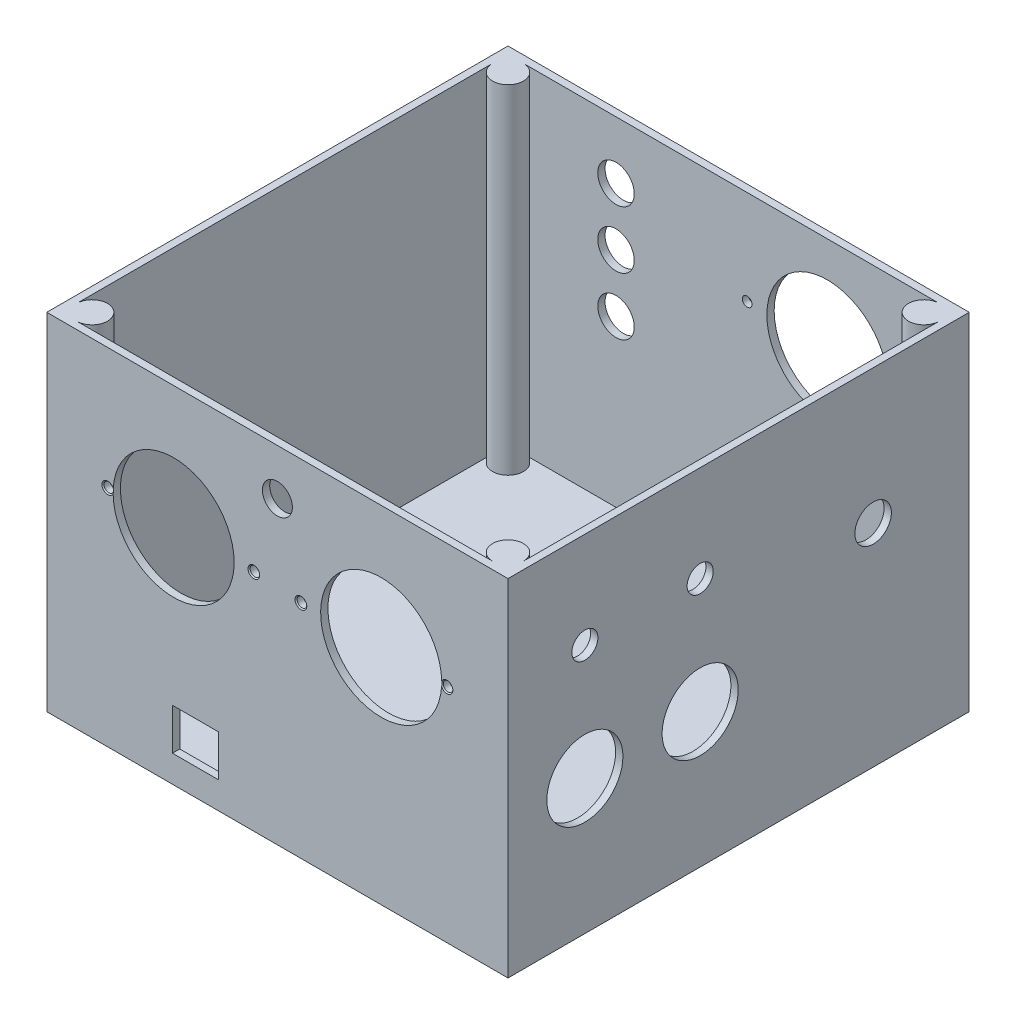
from build123d import *

# Parameters (mm, degrees)
SKETCH1_W                   = 120
SKETCH1_H                   = 120
BOSS_EXTRUDE1_DEPTH         = 90
SKETCH2_W                   = 116.2
SKETCH2_H                   = 116.2
CUT_EXTRUDE1_DEPTH          = 88
BOSS_EXTRUDE2_DEPTH         = 88
CUT_EXTRUDE2_REACH          = 194.094
SKETCH5_R                   = 4.75
SKETCH5_R_2                 = 15.75
CUT_EXTRUDE3_REACH          = 194.094
SKETCH4_R                   = 3.9
SKETCH4_R_2                 = 15.75
SKETCH4_W                   = 12
SKETCH4_H                   = 10.8
CUT_EXTRUDE4_REACH          = 194.094
SKETCH6_R                   = 4.75
SKETCH6_R_2                 = 3.4
SKETCH6_R_3                 = 9.9
M3_TAPPED_HOLE1_D           = 2.5
M3_TAPPED_HOLE1_CSINK_D     = 3.05
M3_TAPPED_HOLE1_CSINK_ANGLE = 90
M3_TAPPED_HOLE3_D           = 2.5
M3_TAPPED_HOLE3_DEPTH       = 7.5
M3_TAPPED_HOLE3_CSINK_D     = 3.05
M3_TAPPED_HOLE3_CSINK_ANGLE = 90
M3_TAPPED_HOLE3_TIP         = 0.751075774
M3_TAPPED_HOLE4_D           = 2.5
M3_TAPPED_HOLE4_DEPTH       = 7.5
M3_TAPPED_HOLE4_CSINK_D     = 3.05
M3_TAPPED_HOLE4_CSINK_ANGLE = 90
M3_TAPPED_HOLE4_TIP         = 0.751075774


with BuildPart() as part:
    # Sketch1 → Boss-Extrude1 (new body)
    with BuildSketch(Plane(origin=(0, 0, 0), x_dir=(1, 0, 0), z_dir=(0, 1, 0))):
        with Locations((60, 60)):
            Rectangle(SKETCH1_W, SKETCH1_H)
    extrude(amount=BOSS_EXTRUDE1_DEPTH)

    # Sketch2 → Cut-Extrude1 (cut)
    with BuildSketch(Plane(origin=(0, 90, 0), x_dir=(1, 0, 0), z_dir=(0, 1, 0))):
        with Locations((60, 60)):
            Rectangle(SKETCH2_W, SKETCH2_H)
    extrude(amount=-CUT_EXTRUDE1_DEPTH, mode=Mode.SUBTRACT)

    # Sketch3 → Boss-Extrude2 (add)
    with BuildSketch(Plane(origin=(0, 2, 0), x_dir=(1, 0, 0), z_dir=(0, 1, 0))):
        with BuildLine():
            Line((5.9, 118.1), (1.9, 118.1))
            Line((1.9, 118.1), (1.9, 114.1))
            ThreePointArc((1.9, 114.1), (8.728427125, 111.271572875), (5.9, 118.1))
        make_face()
        with BuildLine():
            Line((114.1, 118.1), (118.1, 118.1))
            Line((118.1, 118.1), (118.1, 114.1))
            ThreePointArc((118.1, 114.1), (111.271572875, 111.271572875), (114.1, 118.1))
        make_face()
        with BuildLine():
            Line((118.1, 1.9), (118.1, 5.9))
            ThreePointArc((118.1, 5.9), (111.271572875, 8.728427125), (114.1, 1.9))
            Line((114.1, 1.9), (118.1, 1.9))
        make_face()
        with BuildLine():
            Line((1.9, 1.9), (1.9, 5.9))
            ThreePointArc((1.9, 5.9), (8.728427125, 8.728427125), (5.9, 1.9))
            Line((5.9, 1.9), (1.9, 1.9))
        make_face()
    extrude(amount=BOSS_EXTRUDE2_DEPTH)

    # Sketch5 → Cut-Extrude2 (cut, up to next)
    with BuildSketch(Plane.XY.offset(-120), mode=Mode.PRIVATE) as cut_extrude2_sk1:
        with Locations(Location((30, 75, 0), (0, 0, 180))):
            Circle(SKETCH5_R)
    cut_extrude2_tool1 = extrude(cut_extrude2_sk1.sketch, amount=CUT_EXTRUDE2_REACH, mode=Mode.PRIVATE) & part.part
    # Sketch5 → Cut-Extrude2 (cut, up to next)
    with BuildSketch(Plane.XY.offset(-120), mode=Mode.PRIVATE) as cut_extrude2_sk2:
        with Locations(Location((85, 65, 0), (0, 0, 180))):
            Circle(SKETCH5_R_2)
    cut_extrude2_tool2 = extrude(cut_extrude2_sk2.sketch, amount=CUT_EXTRUDE2_REACH, mode=Mode.PRIVATE) & part.part
    # Sketch5 → Cut-Extrude2 (cut, up to next)
    with BuildSketch(Plane.XY.offset(-120), mode=Mode.PRIVATE) as cut_extrude2_sk3:
        with Locations(Location((30, 60, 0), (0, 0, 180))):
            Circle(SKETCH5_R)
    cut_extrude2_tool3 = extrude(cut_extrude2_sk3.sketch, amount=CUT_EXTRUDE2_REACH, mode=Mode.PRIVATE) & part.part
    # Sketch5 → Cut-Extrude2 (cut, up to next)
    with BuildSketch(Plane.XY.offset(-120), mode=Mode.PRIVATE) as cut_extrude2_sk4:
        with Locations(Location((30, 45, 0), (0, 0, 180))):
            Circle(SKETCH5_R)
    cut_extrude2_tool4 = extrude(cut_extrude2_sk4.sketch, amount=CUT_EXTRUDE2_REACH, mode=Mode.PRIVATE) & part.part
    add(cut_extrude2_tool1.solids().sort_by_distance((30, 75, -120))[0], mode=Mode.SUBTRACT)
    add(cut_extrude2_tool2.solids().sort_by_distance((85, 65, -120))[0], mode=Mode.SUBTRACT)
    add(cut_extrude2_tool3.solids().sort_by_distance((30, 60, -120))[0], mode=Mode.SUBTRACT)
    add(cut_extrude2_tool4.solids().sort_by_distance((30, 45, -120))[0], mode=Mode.SUBTRACT)

    # Sketch4 → Cut-Extrude3 (cut, up to next)
    with BuildSketch(Plane.XY, mode=Mode.PRIVATE) as cut_extrude3_sk1:
        with Locations((60, 78)):
            Circle(SKETCH4_R)
    cut_extrude3_tool1 = extrude(cut_extrude3_sk1.sketch, amount=-CUT_EXTRUDE3_REACH, mode=Mode.PRIVATE) & part.part
    # Sketch4 → Cut-Extrude3 (cut, up to next)
    with BuildSketch(Plane.XY, mode=Mode.PRIVATE) as cut_extrude3_sk2:
        with Locations((33, 58)):
            Circle(SKETCH4_R_2)
    cut_extrude3_tool2 = extrude(cut_extrude3_sk2.sketch, amount=-CUT_EXTRUDE3_REACH, mode=Mode.PRIVATE) & part.part
    # Sketch4 → Cut-Extrude3 (cut, up to next)
    with BuildSketch(Plane.XY, mode=Mode.PRIVATE) as cut_extrude3_sk3:
        with Locations((87, 58)):
            Circle(SKETCH4_R_2)
    cut_extrude3_tool3 = extrude(cut_extrude3_sk3.sketch, amount=-CUT_EXTRUDE3_REACH, mode=Mode.PRIVATE) & part.part
    # Sketch4 → Cut-Extrude3 (cut, up to next)
    with BuildSketch(Plane.XY, mode=Mode.PRIVATE) as cut_extrude3_sk4:
        with Locations((38.7, 12.4)):
            Rectangle(SKETCH4_W, SKETCH4_H)
    cut_extrude3_tool4 = extrude(cut_extrude3_sk4.sketch, amount=-CUT_EXTRUDE3_REACH, mode=Mode.PRIVATE) & part.part
    add(cut_extrude3_tool1.solids().sort_by_distance((60, 78, 0))[0], mode=Mode.SUBTRACT)
    add(cut_extrude3_tool2.solids().sort_by_distance((33, 58, 0))[0], mode=Mode.SUBTRACT)
    add(cut_extrude3_tool3.solids().sort_by_distance((87, 58, 0))[0], mode=Mode.SUBTRACT)
    add(cut_extrude3_tool4.solids().sort_by_distance((38.7, 12.4, 0))[0], mode=Mode.SUBTRACT)

    # Sketch6 → Cut-Extrude4 (cut, up to next)
    with BuildSketch(Plane(origin=(120, 0, 0), x_dir=(0, 0, -1), z_dir=(1, 0, 0)), mode=Mode.PRIVATE) as cut_extrude4_sk1:
        with Locations((95, 55)):
            Circle(SKETCH6_R)
    cut_extrude4_tool1 = extrude(cut_extrude4_sk1.sketch, amount=-CUT_EXTRUDE4_REACH, mode=Mode.PRIVATE) & part.part
    # Sketch6 → Cut-Extrude4 (cut, up to next)
    with BuildSketch(Plane(origin=(120, 0, 0), x_dir=(0, 0, -1), z_dir=(1, 0, 0)), mode=Mode.PRIVATE) as cut_extrude4_sk2:
        with Locations((20, 65)):
            Circle(SKETCH6_R_2)
    cut_extrude4_tool2 = extrude(cut_extrude4_sk2.sketch, amount=-CUT_EXTRUDE4_REACH, mode=Mode.PRIVATE) & part.part
    # Sketch6 → Cut-Extrude4 (cut, up to next)
    with BuildSketch(Plane(origin=(120, 0, 0), x_dir=(0, 0, -1), z_dir=(1, 0, 0)), mode=Mode.PRIVATE) as cut_extrude4_sk3:
        with Locations((50, 65)):
            Circle(SKETCH6_R_2)
    cut_extrude4_tool3 = extrude(cut_extrude4_sk3.sketch, amount=-CUT_EXTRUDE4_REACH, mode=Mode.PRIVATE) & part.part
    # Sketch6 → Cut-Extrude4 (cut, up to next)
    with BuildSketch(Plane(origin=(120, 0, 0), x_dir=(0, 0, -1), z_dir=(1, 0, 0)), mode=Mode.PRIVATE) as cut_extrude4_sk4:
        with Locations((20, 35)):
            Circle(SKETCH6_R_3)
    cut_extrude4_tool4 = extrude(cut_extrude4_sk4.sketch, amount=-CUT_EXTRUDE4_REACH, mode=Mode.PRIVATE) & part.part
    # Sketch6 → Cut-Extrude4 (cut, up to next)
    with BuildSketch(Plane(origin=(120, 0, 0), x_dir=(0, 0, -1), z_dir=(1, 0, 0)), mode=Mode.PRIVATE) as cut_extrude4_sk5:
        with Locations((50, 35)):
            Circle(SKETCH6_R_3)
    cut_extrude4_tool5 = extrude(cut_extrude4_sk5.sketch, amount=-CUT_EXTRUDE4_REACH, mode=Mode.PRIVATE) & part.part
    add(cut_extrude4_tool1.solids().sort_by_distance((120, 55, -95))[0], mode=Mode.SUBTRACT)
    add(cut_extrude4_tool2.solids().sort_by_distance((120, 65, -20))[0], mode=Mode.SUBTRACT)
    add(cut_extrude4_tool3.solids().sort_by_distance((120, 65, -50))[0], mode=Mode.SUBTRACT)
    add(cut_extrude4_tool4.solids().sort_by_distance((120, 35, -20))[0], mode=Mode.SUBTRACT)
    add(cut_extrude4_tool5.solids().sort_by_distance((120, 35, -50))[0], mode=Mode.SUBTRACT)

    # M3 Tapped Hole1 (through all)
    with Locations(Plane(origin=(44.517722268, 2, -162.246849146), x_dir=(1, 0, 0), z_dir=(0, 1, 0))):
        with Locations((-18.417722268, -139.446849146), (-3.217722268, -88.646849146), (24.682277732, -88.646849146), (29.382277732, -140.546849146)):
            CounterSinkHole(M3_TAPPED_HOLE1_D / 2, M3_TAPPED_HOLE1_CSINK_D / 2, counter_sink_angle=M3_TAPPED_HOLE1_CSINK_ANGLE)

    # M3 Tapped Hole3
    with Locations(Plane(origin=(44.517722268, -28.75570348, 0), x_dir=(1, 0, 0), z_dir=(0, 0, 1))):
        with Locations((-28.646696043, 87.124935168), (9.359552373, 87.17416606), (21.605003092, 86.3372409), (59.611251507, 86.386471792)):
            CounterSinkHole(M3_TAPPED_HOLE3_D / 2, M3_TAPPED_HOLE3_CSINK_D / 2, depth=M3_TAPPED_HOLE3_DEPTH, counter_sink_angle=M3_TAPPED_HOLE3_CSINK_ANGLE)
            with Locations((0, 0, -(M3_TAPPED_HOLE3_DEPTH + M3_TAPPED_HOLE3_TIP / 2))):  # 118° drill point
                Cone(0, M3_TAPPED_HOLE3_D / 2, M3_TAPPED_HOLE3_TIP, mode=Mode.SUBTRACT)

    # M3 Tapped Hole4
    with Locations(Plane(origin=(44.517722268, -28.75570348, -120), x_dir=(-1, 0, 0), z_dir=(0, 0, -1))):
        with Locations((-57.611251507, 94.124935168), (-19.605003092, 94.17416606)):
            CounterSinkHole(M3_TAPPED_HOLE4_D / 2, M3_TAPPED_HOLE4_CSINK_D / 2, depth=M3_TAPPED_HOLE4_DEPTH, counter_sink_angle=M3_TAPPED_HOLE4_CSINK_ANGLE)
            with Locations((0, 0, -(M3_TAPPED_HOLE4_DEPTH + M3_TAPPED_HOLE4_TIP / 2))):  # 118° drill point
                Cone(0, M3_TAPPED_HOLE4_D / 2, M3_TAPPED_HOLE4_TIP, mode=Mode.SUBTRACT)


solid = part.part
